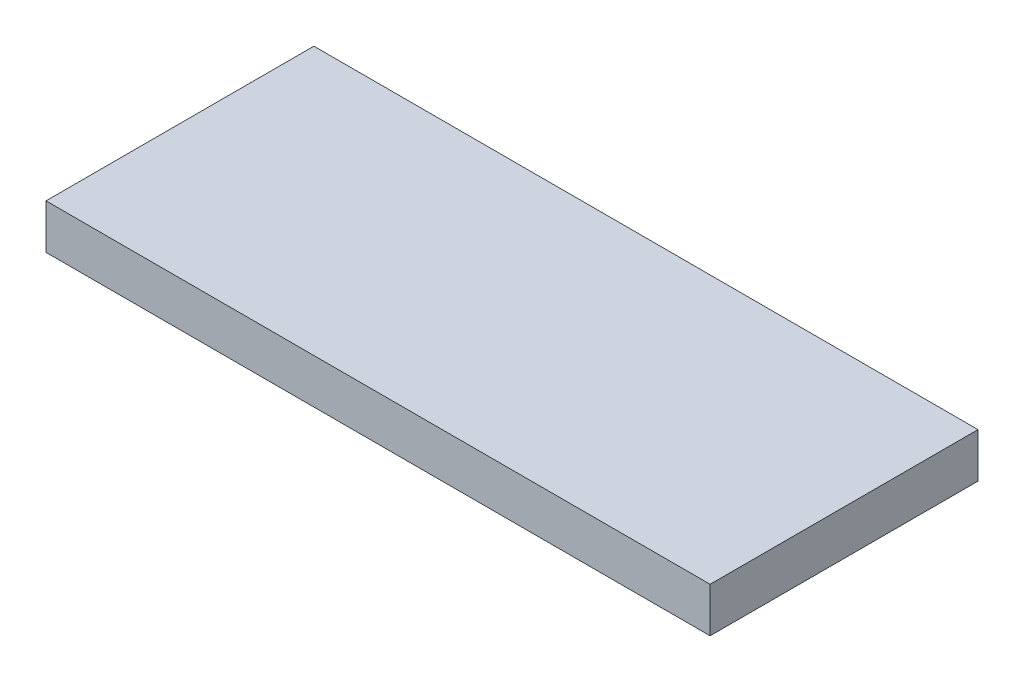
from build123d import *

# Parameters (mm, degrees)
BOSS_EXTRUDE1_DEPTH = 38.1
SKETCH2_R           = 11.049
CUT_EXTRUDE1_DEPTH  = 6.35
SKETCH2_4_R         = 3.556
CUT_EXTRUDE2_DEPTH  = 6.35
SKETCH4_W           = 14.244414607
SKETCH4_H           = 36.472405425
SKETCH4_W_2         = 34.84093086
SKETCH4_H_2         = 80.147164796
CUT_EXTRUDE4_DEPTH  = 76.2


with BuildPart() as part:
    # Sketch1 → Boss-Extrude1 (new body)
    with BuildSketch(Plane.XY):
        Polygon((0, 76.2), (0, 0), (6.35, 0), (6.35, 69.85), (94.447991824, 69.85), (94.447991824, 101.6), (88.097991824, 101.6), (88.097991824, 76.2), align=None)
    extrude(amount=BOSS_EXTRUDE1_DEPTH)

    # Sketch2 → Cut-Extrude1 (cut)
    with BuildSketch(Plane.ZY):
        with Locations((19.05, 20.32)):
            Circle(SKETCH2_R)
    extrude(amount=-CUT_EXTRUDE1_DEPTH, mode=Mode.SUBTRACT)

    # Sketch2<4> → Cut-Extrude2 (cut)
    with BuildSketch(Plane.ZY):
        with Locations((19.05, 42.672)):
            Circle(SKETCH2_4_R)
    extrude(amount=-CUT_EXTRUDE2_DEPTH, mode=Mode.SUBTRACT)

    # Sketch4 → Cut-Extrude4 (cut)
    with BuildSketch(Plane.XY.offset(38.1)):
        with Locations((95.220199127, 94.436202713)):
            Rectangle(SKETCH4_W, SKETCH4_H)
        with Locations((-11.07046543, 29.776417602)):
            Rectangle(SKETCH4_W_2, SKETCH4_H_2)
    extrude(amount=-CUT_EXTRUDE4_DEPTH, mode=Mode.SUBTRACT)


solid = part.part
